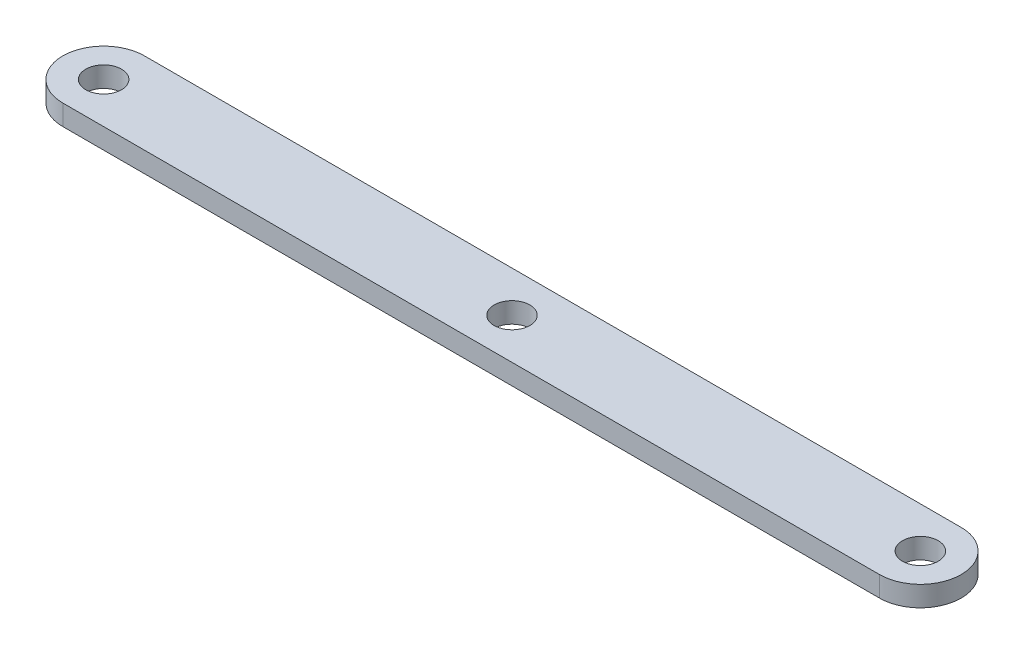
from build123d import *

# Parameters (mm, degrees)
EXTRUDE_1_DEPTH     = 2
SKETCH_2_R          = 1.75
CUT_EXTRUDE_1_DEPTH = 50.107311212


with BuildPart() as part:
    # 草图1 → 凸台-拉伸1 (new body)
    with BuildSketch(Plane(origin=(0, 0, 0), x_dir=(1, 0, 0), z_dir=(0, 1, 0))):
        with BuildLine():
            Line((-44.903251574, 4), (35.096748426, 4))
            ThreePointArc((35.096748426, 4), (39.096748426, 0), (35.096748426, -4))
            Line((35.096748426, -4), (-44.903251574, -4))
            ThreePointArc((-44.903251574, -4), (-48.903251574, 0), (-44.903251574, 4))
        make_face()
    extrude(amount=EXTRUDE_1_DEPTH)

    # 草图2 → 切除-拉伸1 (cut, through all)
    with BuildSketch(Plane(origin=(0, 2, 0), x_dir=(1, 0, 0), z_dir=(0, 1, 0))):
        with Locations(Location((-44.903251574, 0, 0), (0, 0, 270))):
            Circle(SKETCH_2_R)
        with Locations(Location((35.096748426, 0, 0), (0, 0, 270))):
            Circle(SKETCH_2_R)
        with Locations(Location((-4.903251574, 0, 0), (0, 0, 270))):
            Circle(SKETCH_2_R)
    extrude(amount=-CUT_EXTRUDE_1_DEPTH, mode=Mode.SUBTRACT)


solid = part.part
